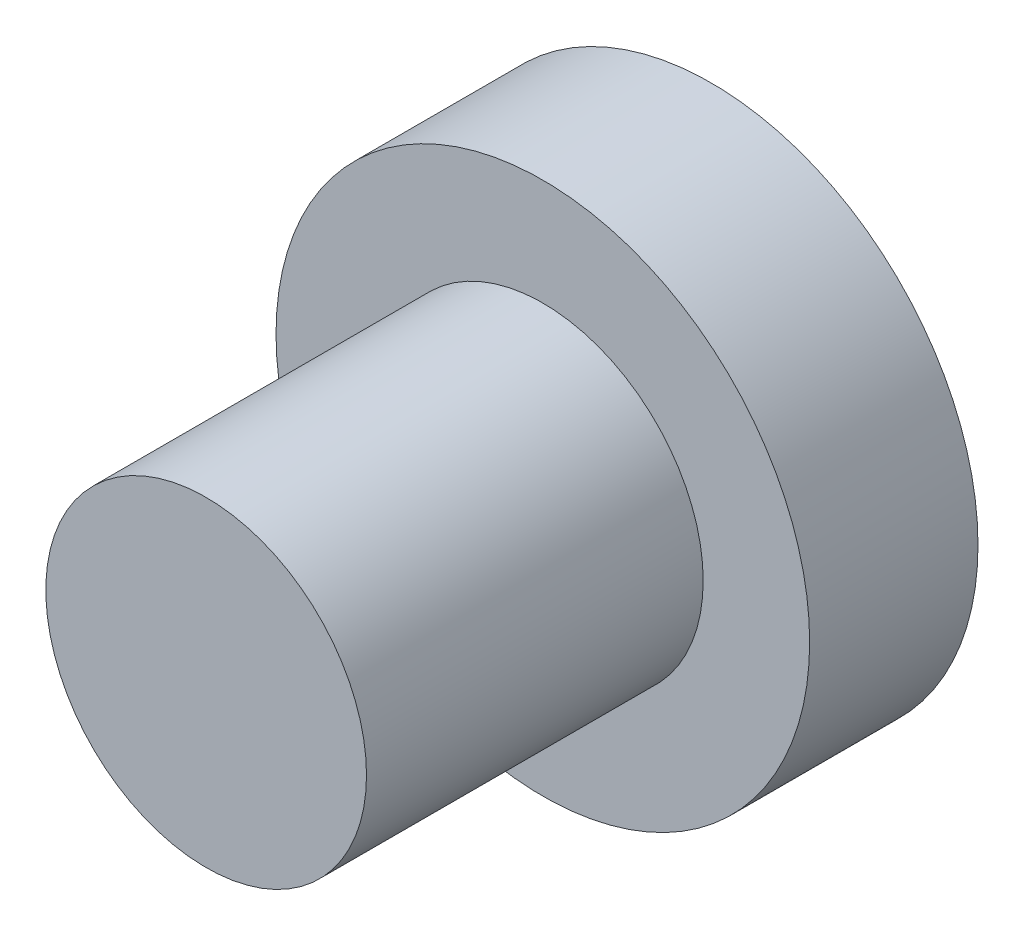
from build123d import *

# Parameters (mm, degrees)
SKETCH1_R      = 7.925
EXTRUDE1_DEPTH = 5
SKETCH2_R      = 4.7625
EXTRUDE2_DEPTH = 10


with BuildPart() as part:
    # Sketch1 → Extrude1 (new body)
    with BuildSketch(Plane.XY):
        Circle(SKETCH1_R)
    extrude(amount=EXTRUDE1_DEPTH)

    # Sketch2 → Extrude2 (add)
    with BuildSketch(Plane.XY.offset(5)):
        Circle(SKETCH2_R)
    extrude(amount=EXTRUDE2_DEPTH)


solid = part.part
